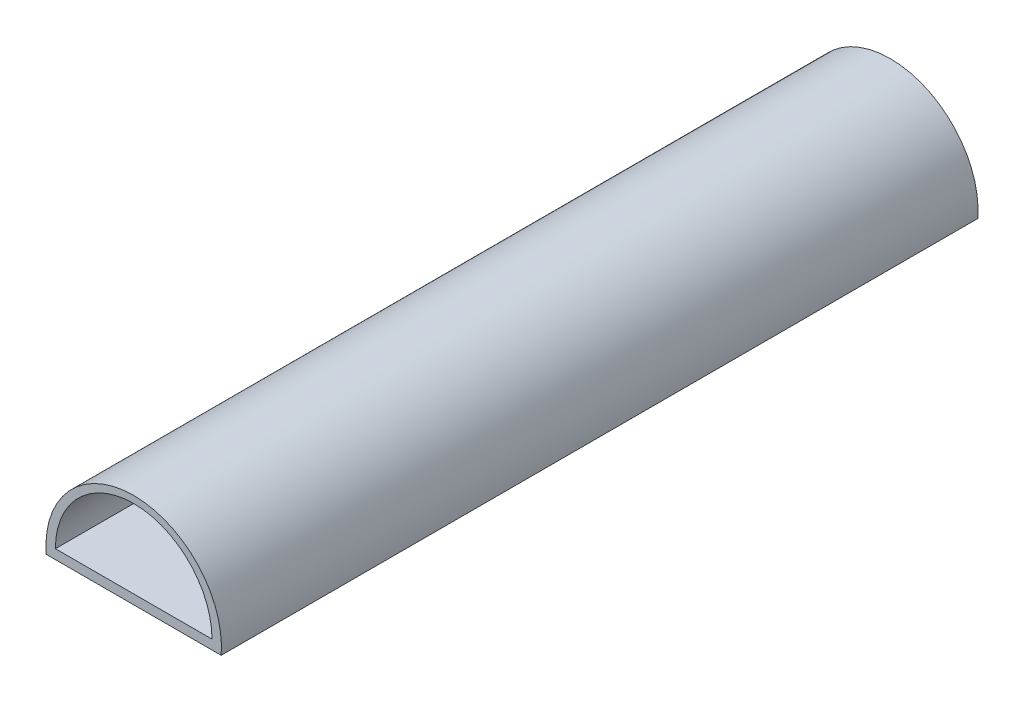
from build123d import *

# Parameters (mm, degrees)
BOSS_EXTRUDE2_DEPTH = 127


with BuildPart() as part:
    # Sketch1 → Boss-Extrude2 (new body)
    with BuildSketch(Plane.XY):
        with BuildLine():
            Line((-23.111377793, -10.048425127), (6.257372207, -10.048425127))
            ThreePointArc((6.257372207, -10.048425127), (-8.427002793, 5.85418124), (-23.111377793, -10.048425127))
        make_face()
        with BuildLine():
            Line((-8.427002793, -8.460925127), (-21.571502793, -8.460925127))
            ThreePointArc((-21.571502793, -8.460925127), (-8.427002793, 4.683574873), (4.717497207, -8.460925127))
            Line((4.717497207, -8.460925127), (-8.427002793, -8.460925127))
        make_face(mode=Mode.SUBTRACT)
    extrude(amount=BOSS_EXTRUDE2_DEPTH)


solid = part.part
